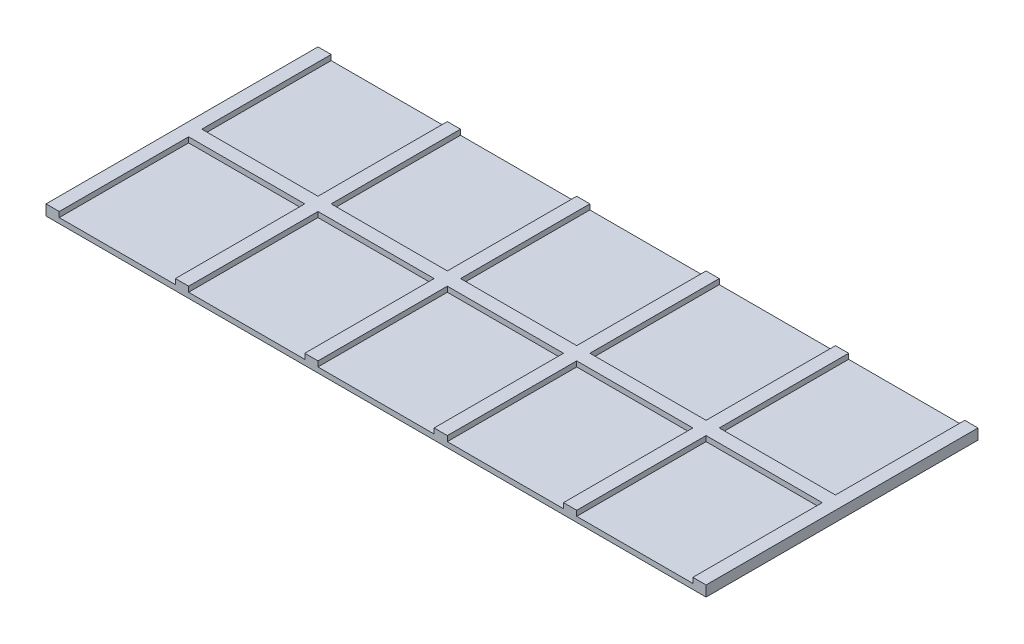
from build123d import *

# Parameters (mm, degrees)
BOSS_EXTRUDE1_DEPTH = 10
SKETCH2_W           = 1250.061929379
SKETCH2_H           = 515
BOSS_EXTRUDE2_DEPTH = 10


with BuildPart() as part:
    # Sketch1 → Boss-Extrude1 (new body)
    with BuildSketch(Plane(origin=(0, 0, 0), x_dir=(1, 0, 0), z_dir=(0, 1, 0))):
        Polygon((-110, 128.75), (-135, 128.75), (-135, -116.25), (-355, -116.25), (-355, 128.75), (-380, 128.75), (-380, -116.25), (-600, -116.25), (-600, 128.75), (-625, 128.75), (-625, -386.25), (-600, -386.25), (-600, -141.25), (-380, -141.25), (-380, -386.25), (-355, -386.25), (-355, -141.25), (-135, -141.25), (-135, -386.25), (-110, -386.25), (-110, -141.25), (110, -141.25), (110, -386.25), (135, -386.25), (135, -141.25), (355, -141.25), (355, -386.25), (380, -386.25), (380, -141.25), (600, -141.25), (600, -386.25), (625, -386.25), (625, 128.75), (600, 128.75), (600, -116.25), (380, -116.25), (380, 128.75), (355, 128.75), (355, -116.25), (135, -116.25), (135, 128.75), (110, 128.75), (110, -116.25), (-110, -116.25), align=None)
    extrude(amount=BOSS_EXTRUDE1_DEPTH)

    # Sketch2 → Boss-Extrude2 (add)
    with BuildSketch(Plane(origin=(0, 0, 0), x_dir=(1, 0, 0), z_dir=(0, 1, 0))):
        with Locations((-0.03096469, -128.75)):
            Rectangle(SKETCH2_W, SKETCH2_H)
    extrude(amount=-BOSS_EXTRUDE2_DEPTH)


solid = part.part
